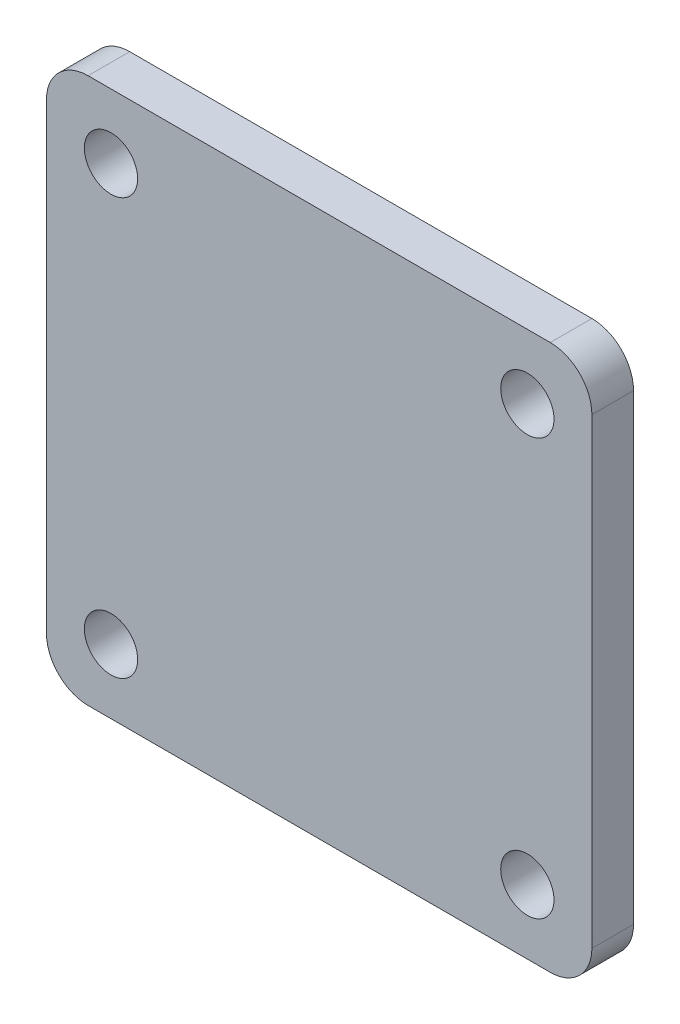
from build123d import *

# Parameters (mm, degrees)
SKETCH_1_W          = 65.5
SKETCH_1_H          = 65.5
EXTRUDE_1_DEPTH     = 5
FILLET_1_R          = 5
SKETCH_7_R          = 3.2
CUT_EXTRUDE_2_DEPTH = 5
CUT_EXTRUDE_START   = -15
SKETCH_3_R          = 3.2
CUT_EXTRUDE_3_DEPTH = 15
EXTRUDE_START       = -5
SKETCH_12_R         = 3.2
EXTRUDE_3_DEPTH     = 5


with BuildPart() as part:
    # 스케치1 → 보스-돌출1 (new body)
    with BuildSketch(Plane.XY):
        Rectangle(SKETCH_1_W, SKETCH_1_H)
    extrude(amount=EXTRUDE_1_DEPTH)

    # 필렛1
    fillet_1_edges = [part.edges().sort_by_distance(p)[0] for p in [
        (-32.75, -32.75, 2.5),
        (32.75, -32.75, 2.5),
        (32.75, 32.75, 2.5),
        (-32.75, 32.75, 2.5),
    ]]
    fillet(fillet_1_edges, radius=FILLET_1_R)

    # 스케치7 → 컷-돌출2 (cut)
    with BuildSketch(Plane(origin=(0, 0, 0), x_dir=(-1, 0, 0), z_dir=(0, 0, -1))):
        with Locations((-25, -25)):
            Circle(SKETCH_7_R)
        with Locations((-25, 25)):
            Circle(SKETCH_7_R)
    extrude(amount=-CUT_EXTRUDE_2_DEPTH, mode=Mode.SUBTRACT)

    # 스케치3 → 컷-돌출3 (cut)
    with BuildSketch(Plane.XY.offset(5).offset(CUT_EXTRUDE_START)):
        with Locations(Location((25, -25, 0), (0, 0, 180))):
            Circle(SKETCH_3_R)
        with Locations(Location((25, 25, 0), (0, 0, 180))):
            Circle(SKETCH_3_R)
        with Locations((25, 0)):
            Circle(SKETCH_3_R)
        with Locations((0, -25)):
            Circle(SKETCH_3_R)
        with Locations((0, 25)):
            Circle(SKETCH_3_R)
        Circle(SKETCH_3_R)
        with Locations((-25, -25)):
            Circle(SKETCH_3_R)
        with Locations((-25, 25)):
            Circle(SKETCH_3_R)
        with Locations((-25, 0)):
            Circle(SKETCH_3_R)
    extrude(amount=CUT_EXTRUDE_3_DEPTH, mode=Mode.SUBTRACT)

    # 스케치12 → 보스-돌출3 (add)
    with BuildSketch(Plane.XY.offset(5).offset(EXTRUDE_START)):
        with Locations((25, 0)):
            Circle(SKETCH_12_R)
        Circle(SKETCH_12_R)
        with Locations((0, -25)):
            Circle(SKETCH_12_R)
        with Locations((0, 25)):
            Circle(SKETCH_12_R)
        with Locations((-25, 0)):
            Circle(SKETCH_12_R)
    extrude(amount=EXTRUDE_3_DEPTH)


solid = part.part
